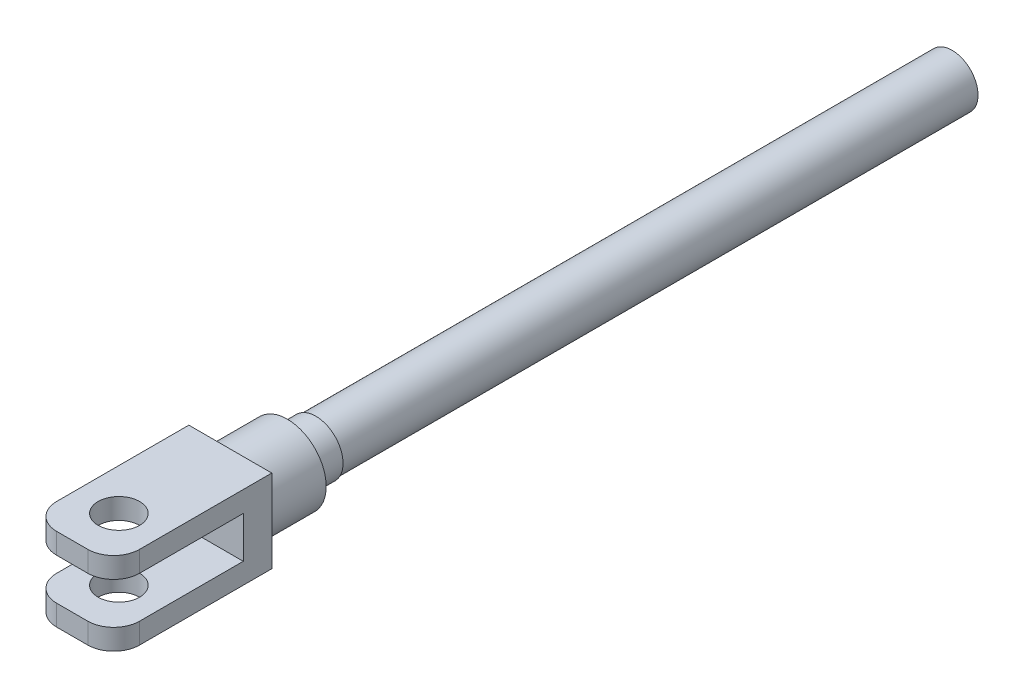
from build123d import *

# Parameters (mm, degrees)
SKETCH1_R           = 10
BOSS_EXTRUDE1_DEPTH = 245.53
SKETCH2_R           = 10.5
BOSS_EXTRUDE2_DEPTH = 11
SKETCH3_R           = 15
BOSS_EXTRUDE3_DEPTH = 22
SKETCH4_W           = 32
SKETCH4_H           = 32
BOSS_EXTRUDE4_DEPTH = 61
SKETCH5_W           = 50
SKETCH5_H           = 16
CUT_EXTRUDE1_DEPTH  = 58
SKETCH6_R           = 8
CUT_EXTRUDE2_DEPTH  = 58
FILLET1_R           = 10


with BuildPart() as part:
    # Sketch1 → Boss-Extrude1 (new body)
    with BuildSketch(Plane.XY):
        with Locations(Location((0, 0, 0), (0, 0, 180))):
            Circle(SKETCH1_R)
    extrude(amount=BOSS_EXTRUDE1_DEPTH)

    # Sketch2 → Boss-Extrude2 (add)
    with BuildSketch(Plane.XY.offset(245.53)):
        Circle(SKETCH2_R)
    extrude(amount=BOSS_EXTRUDE2_DEPTH)

    # Sketch3 → Boss-Extrude3 (add)
    with BuildSketch(Plane.XY.offset(256.53)):
        Circle(SKETCH3_R)
    extrude(amount=BOSS_EXTRUDE3_DEPTH)

    # Sketch4 → Boss-Extrude4 (add)
    with BuildSketch(Plane.XY.offset(278.53)):
        Rectangle(SKETCH4_W, SKETCH4_H)
    extrude(amount=BOSS_EXTRUDE4_DEPTH)

    # Sketch5 → Cut-Extrude1 (cut)
    with BuildSketch(Plane.ZY.offset(16)):
        with Locations((314.53, 0)):
            Rectangle(SKETCH5_W, SKETCH5_H)
    extrude(amount=-CUT_EXTRUDE1_DEPTH, mode=Mode.SUBTRACT)

    # Sketch6 → Cut-Extrude2 (cut)
    with BuildSketch(Plane(origin=(0, 16, 0), x_dir=(1, 0, 0), z_dir=(0, 1, 0))):
        with Locations(Location((0, -321.53, 0), (0, 0, 270))):
            Circle(SKETCH6_R)
    extrude(amount=-CUT_EXTRUDE2_DEPTH, mode=Mode.SUBTRACT)

    # Fillet1
    fillet1_edges = [part.edges().sort_by_distance(p)[0] for p in [
        (16, -12, 339.53),
        (-16, 12, 339.53),
        (16, 12, 339.53),
        (-16, -12, 339.53),
    ]]
    fillet(fillet1_edges, radius=FILLET1_R)


solid = part.part
